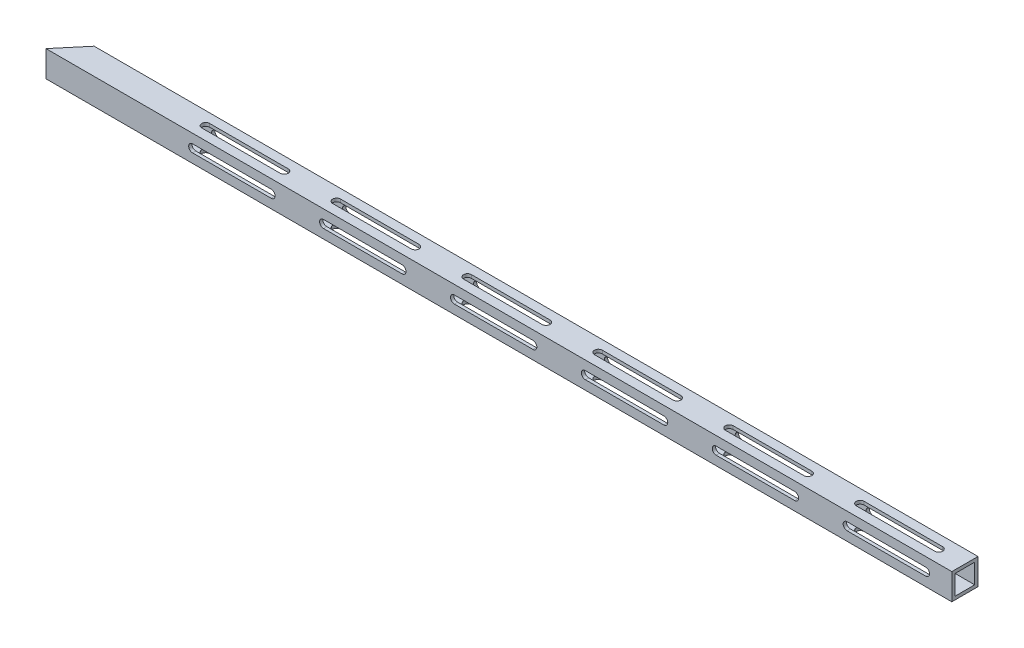
from build123d import *

# Parameters (mm, degrees)
BOSS_EXTRUDE1_DEPTH      = 254
BOSS_EXTRUDE1_DEPTH_BACK = 185.42
SKETCH1_W                = 12.7
SKETCH1_H                = 12.7
SKETCH1_W_2              = 9.525
SKETCH1_H_2              = 9.525
CUT_EXTRUDE1_DEPTH       = 255.158700422
CUT_EXTRUDE1_DEPTH_BACK  = 255.158700422
CUT_EXTRUDE2_DEPTH       = 255.396565425
CUT_EXTRUDE3_DEPTH       = 255.396565425


with BuildPart() as part:
    # Sketch1 → Boss-Extrude1 (new, two sides: drawn at the far end of the back side and taken through both)
    with BuildSketch(Plane(origin=(0, 0, 0), x_dir=(0, 0, -1), z_dir=(1, 0, 0)).offset(-BOSS_EXTRUDE1_DEPTH_BACK)):
        Rectangle(SKETCH1_W, SKETCH1_H)
        Rectangle(SKETCH1_W_2, SKETCH1_H_2, mode=Mode.SUBTRACT)
    extrude(amount=BOSS_EXTRUDE1_DEPTH + BOSS_EXTRUDE1_DEPTH_BACK)

    # Sketch2 → Cut-Extrude1 (cut, two sides: drawn at the far end of the back side and taken through both)
    with BuildSketch(Plane(origin=(0, 0, 0), x_dir=(1, 0, 0), z_dir=(0, 1, 0)).offset(-CUT_EXTRUDE1_DEPTH_BACK)):
        Polygon((-185.42, -6.35), (-174.250456919, 6.961343094), (-183.078216502, 14.368712905), (-194.247759583, 1.057369811), align=None)
    extrude(amount=CUT_EXTRUDE1_DEPTH + CUT_EXTRUDE1_DEPTH_BACK, mode=Mode.SUBTRACT)

    # Sketch3 → Cut-Extrude2 (cut, through all)
    with BuildSketch(Plane(origin=(0, 6.35, 0), x_dir=(1, 0, 0), z_dir=(0, 1, 0))):
        with BuildLine():
            Line((-114.3, 1.905), (-76.2, 1.905))
            ThreePointArc((-76.2, 1.905), (-74.295, 0), (-76.2, -1.905))
            Line((-76.2, -1.905), (-114.3, -1.905))
            ThreePointArc((-114.3, -1.905), (-116.205, 0), (-114.3, 1.905))
        make_face()
        with BuildLine():
            Line((-50.8, 1.905), (-12.7, 1.905))
            ThreePointArc((-12.7, 1.905), (-10.795, 0), (-12.7, -1.905))
            Line((-12.7, -1.905), (-50.8, -1.905))
            ThreePointArc((-50.8, -1.905), (-52.705, 0), (-50.8, 1.905))
        make_face()
        with BuildLine():
            Line((12.7, 1.905), (50.8, 1.905))
            ThreePointArc((50.8, 1.905), (52.705, 0), (50.8, -1.905))
            Line((50.8, -1.905), (12.7, -1.905))
            ThreePointArc((12.7, -1.905), (10.795, 0), (12.7, 1.905))
        make_face()
        with BuildLine():
            Line((76.2, 1.905), (114.3, 1.905))
            ThreePointArc((114.3, 1.905), (116.205, 0), (114.3, -1.905))
            Line((114.3, -1.905), (76.2, -1.905))
            ThreePointArc((76.2, -1.905), (74.295, 0), (76.2, 1.905))
        make_face()
        with BuildLine():
            Line((139.7, 1.905), (177.8, 1.905))
            ThreePointArc((177.8, 1.905), (179.705, 0), (177.8, -1.905))
            Line((177.8, -1.905), (139.7, -1.905))
            ThreePointArc((139.7, -1.905), (137.795, 0), (139.7, 1.905))
        make_face()
        with BuildLine():
            Line((203.2, 1.905), (241.3, 1.905))
            ThreePointArc((241.3, 1.905), (243.205, 0), (241.3, -1.905))
            Line((241.3, -1.905), (203.2, -1.905))
            ThreePointArc((203.2, -1.905), (201.295, 0), (203.2, 1.905))
        make_face()
    extrude(amount=-CUT_EXTRUDE2_DEPTH, mode=Mode.SUBTRACT)

    # Sketch4 → Cut-Extrude3 (cut, through all)
    with BuildSketch(Plane.XY.offset(6.35)):
        with BuildLine():
            Line((-114.3, 1.905), (-76.2, 1.905))
            ThreePointArc((-76.2, 1.905), (-74.295, 0), (-76.2, -1.905))
            Line((-76.2, -1.905), (-114.3, -1.905))
            ThreePointArc((-114.3, -1.905), (-116.205, 0), (-114.3, 1.905))
        make_face()
        with BuildLine():
            Line((-50.8, 1.905), (-12.7, 1.905))
            ThreePointArc((-12.7, 1.905), (-10.795, 0), (-12.7, -1.905))
            Line((-12.7, -1.905), (-50.8, -1.905))
            ThreePointArc((-50.8, -1.905), (-52.705, 0), (-50.8, 1.905))
        make_face()
        with BuildLine():
            Line((12.7, 1.905), (50.8, 1.905))
            ThreePointArc((50.8, 1.905), (52.705, 0), (50.8, -1.905))
            Line((50.8, -1.905), (12.7, -1.905))
            ThreePointArc((12.7, -1.905), (10.795, 0), (12.7, 1.905))
        make_face()
        with BuildLine():
            Line((76.2, 1.905), (114.3, 1.905))
            ThreePointArc((114.3, 1.905), (116.205, 0), (114.3, -1.905))
            Line((114.3, -1.905), (76.2, -1.905))
            ThreePointArc((76.2, -1.905), (74.295, 0), (76.2, 1.905))
        make_face()
        with BuildLine():
            Line((139.7, 1.905), (177.8, 1.905))
            ThreePointArc((177.8, 1.905), (179.705, 0), (177.8, -1.905))
            Line((177.8, -1.905), (139.7, -1.905))
            ThreePointArc((139.7, -1.905), (137.795, 0), (139.7, 1.905))
        make_face()
        with BuildLine():
            Line((203.2, 1.905), (241.3, 1.905))
            ThreePointArc((241.3, 1.905), (243.205, 0), (241.3, -1.905))
            Line((241.3, -1.905), (203.2, -1.905))
            ThreePointArc((203.2, -1.905), (201.295, 0), (203.2, 1.905))
        make_face()
    extrude(amount=-CUT_EXTRUDE3_DEPTH, mode=Mode.SUBTRACT)


solid = part.part
